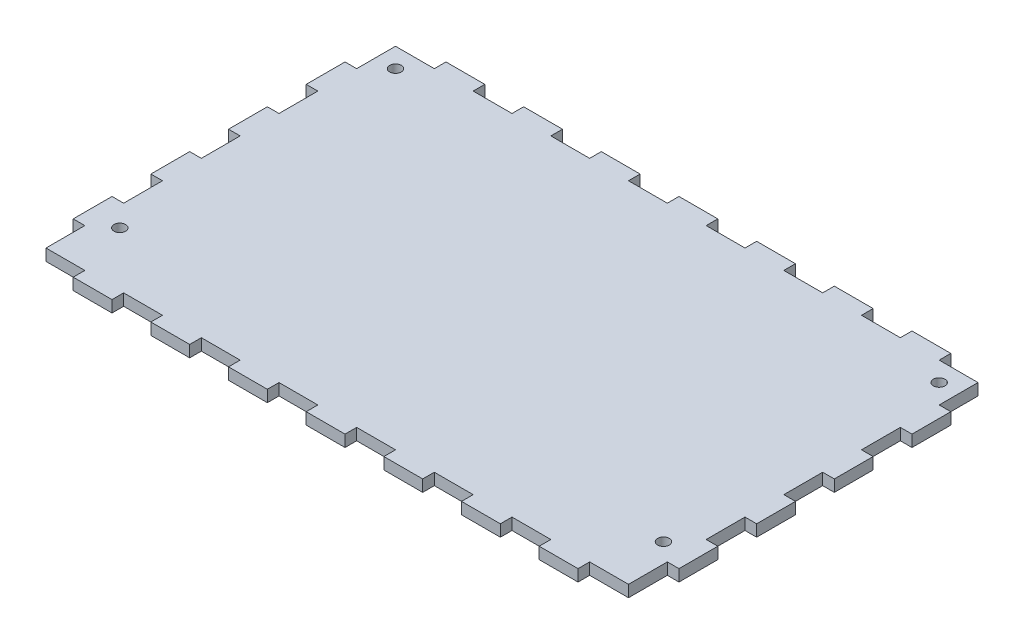
from build123d import *

# Parameters (mm, degrees)
BOSS_EXTRUDE1_DEPTH = 3
SKETCH2_R           = 1.5
CUT_EXTRUDE1_DEPTH  = 3


with BuildPart() as part:
    # Sketch1 → Boss-Extrude1 (new body)
    with BuildSketch(Plane(origin=(0, 0, 0), x_dir=(1, 0, 0), z_dir=(0, 1, 0))):
        Polygon((-5, 48), (5, 48), (5, 45), (15, 45), (15, 48), (25, 48), (25, 45), (35, 45), (35, 48), (45, 48), (45, 45), (55, 45), (55, 48), (65, 48), (65, 45), (75, 45), (75, 35), (78, 35), (78, 25), (75, 25), (75, 15), (78, 15), (78, 5), (75, 5), (75, -5), (78, -5), (78, -15), (75, -15), (75, -25), (78, -25), (78, -35), (75, -35), (75, -45), (65, -45), (65, -48), (55, -48), (55, -45), (45, -45), (45, -48), (35, -48), (35, -45), (25, -45), (25, -48), (15, -48), (15, -45), (5, -45), (5, -48), (-5, -48), (-5, -45), (-15, -45), (-15, -48), (-25, -48), (-25, -45), (-35, -45), (-35, -48), (-45, -48), (-45, -45), (-55, -45), (-55, -48), (-65, -48), (-65, -45), (-75, -45), (-75, -35), (-78, -35), (-78, -25), (-75, -25), (-75, -15), (-78, -15), (-78, -5), (-75, -5), (-75, 5), (-78, 5), (-78, 15), (-75, 15), (-75, 25), (-78, 25), (-78, 35), (-75, 35), (-75, 45), (-65, 45), (-65, 48), (-55, 48), (-55, 45), (-45, 45), (-45, 48), (-35, 48), (-35, 45), (-25, 45), (-25, 48), (-15, 48), (-15, 45), (-5, 45), align=None)
    extrude(amount=BOSS_EXTRUDE1_DEPTH)

    # Sketch2 → Cut-Extrude1 (cut)
    with BuildSketch(Plane(origin=(0, 3, 0), x_dir=(1, 0, 0), z_dir=(0, 1, 0))):
        with Locations(Location((70, 40, 0), (0, 0, 270))):
            Circle(SKETCH2_R)
        with Locations(Location((70, -31, 0), (0, 0, 270))):
            Circle(SKETCH2_R)
        with Locations(Location((-70, 40, 0), (0, 0, 90))):
            Circle(SKETCH2_R)
        with Locations(Location((-70, -31, 0), (0, 0, 90))):
            Circle(SKETCH2_R)
    extrude(amount=-CUT_EXTRUDE1_DEPTH, mode=Mode.SUBTRACT)


solid = part.part
